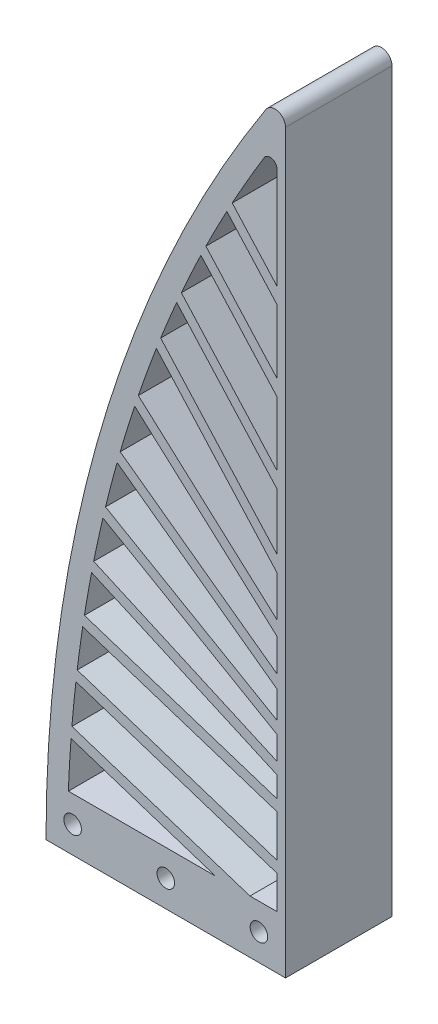
from build123d import *

# Parameters (mm, degrees)
BOSS_EXTRUDE4_DEPTH = 20
SKETCH12_R          = 1.65
CUT_EXTRUDE1_DEPTH  = 149.790905386
CUT_EXTRUDE2_START  = -20
CUT_EXTRUDE2_DEPTH  = 20
CUT_EXTRUDE3_START  = -30
CUT_EXTRUDE3_DEPTH  = 30
BOSS_EXTRUDE5_DEPTH = 20
CIRPATTERN1_COUNT   = 6
CIRPATTERN1_ANGLE   = 30
LPATTERN2_COUNT     = 3
LPATTERN2_PITCH     = 10
BOSS_EXTRUDE6_DEPTH = 20
LPATTERN3_COUNT     = 3
LPATTERN3_PITCH     = 15
CUT_EXTRUDE4_START  = -20
CUT_EXTRUDE4_DEPTH  = 20


with BuildPart() as part:
    # Sketch5 → Boss-Extrude4 (new body)
    with BuildSketch(Plane.XY):
        with BuildLine():
            Line((0, 0), (0, 138.405603612))
            ThreePointArc((0, 138.405603612), (-1.431938837, 140.323234054), (-3.677306515, 139.494934991))
            ThreePointArc((-3.677306515, 139.494934991), (-34.45212059, 72.743387818), (-45, 0))
            Line((-45, 0), (0, 0))
        make_face()
        with BuildLine():
            Line((-1.6, 10), (-40.801596678, 10))
            ThreePointArc((-40.801596678, 10), (-30.171322984, 73.09445494), (-4, 131.480881584))
            ThreePointArc((-4, 131.480881584), (-2.54422163, 132.052107892), (-1.6, 130.805498221))
            Line((-1.6, 130.805498221), (-1.6, 10))
        make_face(mode=Mode.SUBTRACT)
    extrude(amount=BOSS_EXTRUDE4_DEPTH)

    # Sketch12 → Cut-Extrude1 (cut, through all)
    with BuildSketch(Plane.XY.offset(20)):
        with Locations((-40, 5)):
            Circle(SKETCH12_R)
        with Locations((-22.5, 5)):
            Circle(SKETCH12_R)
        with Locations((-5, 5)):
            Circle(SKETCH12_R)
    extrude(amount=-CUT_EXTRUDE1_DEPTH, mode=Mode.SUBTRACT)

    # Sketch17 → Cut-Extrude2 (cut)
    with BuildSketch(Plane.XY.offset(20).offset(CUT_EXTRUDE2_START)):
        Polygon((-109.129206393, -31.174044695), (890.870793607, -18.386269912), (884.13367644, 508.454191469), (-120.638203698, 868.825955305), (-717.462714608, 272.001444394), align=None)
        with BuildLine():
            Line((-45, 0), (0, 0))
            Line((0, 0), (0, 138.405603612))
            ThreePointArc((0, 138.405603612), (-0.890765175, 140.069814567), (-2.769598102, 140.25160436))
            ThreePointArc((-2.769598102, 140.25160436), (-57.041683198, 80.109492203), (-45, 0))
        make_face(mode=Mode.SUBTRACT)
    extrude(amount=CUT_EXTRUDE2_DEPTH, mode=Mode.SUBTRACT)

    # Sketch18 → Cut-Extrude3 (cut)
    with BuildSketch(Plane.XY.offset(20).offset(CUT_EXTRUDE3_START)):
        Polygon((10.567687301, -7.152622061), (26.572035637, 318.782087337), (-234.729728554, 306.471050155), (-205.798791176, -46.855716973), align=None)
        with BuildLine():
            Line((-45, 0), (0, 0))
            Line((0, 0), (0, 138.405603612))
            ThreePointArc((0, 138.405603612), (-1.431938837, 140.323234054), (-3.677306515, 139.494934991))
            ThreePointArc((-3.677306515, 139.494934991), (-34.45212059, 72.743387818), (-45, 0))
        make_face(mode=Mode.SUBTRACT)
    extrude(amount=CUT_EXTRUDE3_DEPTH, mode=Mode.SUBTRACT)

    # Sketch14 → Boss-Extrude5 (add)
    with BuildSketch(Plane.XY.offset(20)):
        Polygon((48.4, 10), (-114.101488266, 62.799934205), (-113.483454278, 64.702047237), (49.018033989, 11.902113033), align=None)
    boss_extrude5 = extrude(amount=-BOSS_EXTRUDE5_DEPTH)

    # CirPattern1: Boss-Extrude5 ×6 about axis
    cirpattern1_axis = Axis((49.018033989, 11.902113033, 0), (0, 0, -1))
    for i in range(1, CIRPATTERN1_COUNT):
        add(boss_extrude5.rotate(cirpattern1_axis, i * CIRPATTERN1_ANGLE / (CIRPATTERN1_COUNT - 1)))

    # LPattern2: Boss-Extrude5 ×3
    with Locations(*[(0, -i * LPATTERN2_PITCH, 0) for i in range(1, LPATTERN2_COUNT)]):
        add(boss_extrude5)

    # Sketch19 → Boss-Extrude6 (add)
    with BuildSketch(Plane.XY.offset(20)):
        Polygon((-1.6, 78.758131997), (-60.025016892, 143.645686936), (-58.538727241, 144.983948149), (-0.113710349, 80.096393209), align=None)
    boss_extrude6 = extrude(amount=-BOSS_EXTRUDE6_DEPTH)

    # LPattern3: Boss-Extrude6 ×3
    with Locations(*[(0, i * LPATTERN3_PITCH, 0) for i in range(1, LPATTERN3_COUNT)]):
        add(boss_extrude6)

    # Sketch20 → Cut-Extrude4 (cut)
    with BuildSketch(Plane.XY.offset(20).offset(CUT_EXTRUDE4_START)):
        Polygon((77.475806055, -29.017161833), (-265.551297842, 6.523481062), (-137.36538358, 367.52057294), (154.147754773, 113.145409747), align=None)
        with BuildLine():
            Line((-45, 0), (0, 0))
            Line((0, 0), (0, 138.405603612))
            ThreePointArc((0, 138.405603612), (-1.431938837, 140.323234054), (-3.677306515, 139.494934991))
            ThreePointArc((-3.677306515, 139.494934991), (-34.45212059, 72.743387818), (-45, 0))
        make_face(mode=Mode.SUBTRACT)
    extrude(amount=CUT_EXTRUDE4_DEPTH, mode=Mode.SUBTRACT)


solid = part.part
